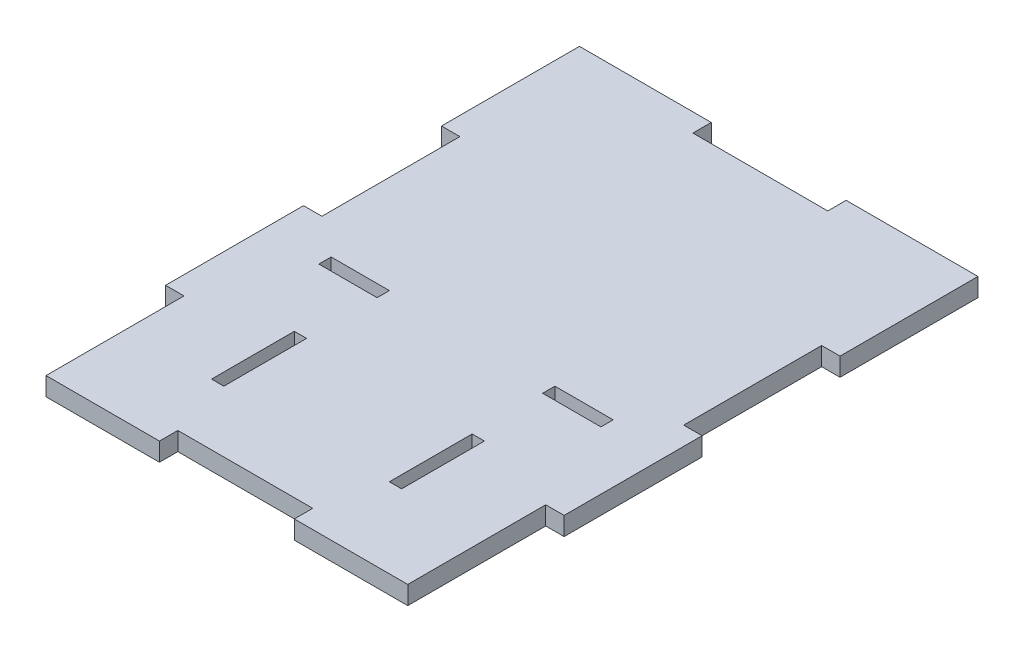
from build123d import *

# Parameters (mm, degrees)
SKETCH1_W           = 130
SKETCH1_H           = 180
BOSS_EXTRUDE1_DEPTH = 6
SKETCH2_W           = 6
SKETCH2_H           = 45
SKETCH2_H_2         = 39
SKETCH2_H_3         = 6
SKETCH2_W_2         = 44
SKETCH2_W_3         = 15
SKETCH2_H_4         = 4
SKETCH2_W_4         = 4
SKETCH2_W_5         = 19
SKETCH2_H_5         = 27
CUT_EXTRUDE1_DEPTH  = 223.117086241


with BuildPart() as part:
    # Sketch1 → Boss-Extrude1 (new body)
    with BuildSketch(Plane(origin=(0, 0, 0), x_dir=(1, 0, 0), z_dir=(0, 1, 0))):
        with Locations((65, 90)):
            Rectangle(SKETCH1_W, SKETCH1_H)
    extrude(amount=BOSS_EXTRUDE1_DEPTH)

    # Sketch2 → Cut-Extrude1 (cut, through all)
    with BuildSketch(Plane(origin=(0, 6, 0), x_dir=(1, 0, 0), z_dir=(0, 1, 0))):
        with Locations((3, 112.5)):
            Rectangle(SKETCH2_W, SKETCH2_H)
        with Locations((3, 25.5)):
            Rectangle(SKETCH2_W, SKETCH2_H_2)
        with Locations((3, 3)):
            Rectangle(SKETCH2_W, SKETCH2_H_3)
        with Locations((127, 22.5)):
            Rectangle(SKETCH2_W, SKETCH2_H)
        with Locations((65, 3)):
            Rectangle(SKETCH2_W_2, SKETCH2_H_3)
        with Locations((127, 112.5)):
            Rectangle(SKETCH2_W, SKETCH2_H)
        with Locations((103.5, 78)):
            Rectangle(SKETCH2_W_3, SKETCH2_H_4)
        with Locations((94, 78)):
            Rectangle(SKETCH2_W_4, SKETCH2_H_4)
        with Locations((28.5, 78)):
            Rectangle(SKETCH2_W_5, SKETCH2_H_4)
        with Locations((36, 39.5)):
            Rectangle(SKETCH2_W_4, SKETCH2_H_5)
        with Locations((94, 39.5)):
            Rectangle(SKETCH2_W_4, SKETCH2_H_5)
        with Locations((65, 177)):
            Rectangle(SKETCH2_W_2, SKETCH2_H_3)
    extrude(amount=-CUT_EXTRUDE1_DEPTH, mode=Mode.SUBTRACT)


solid = part.part
